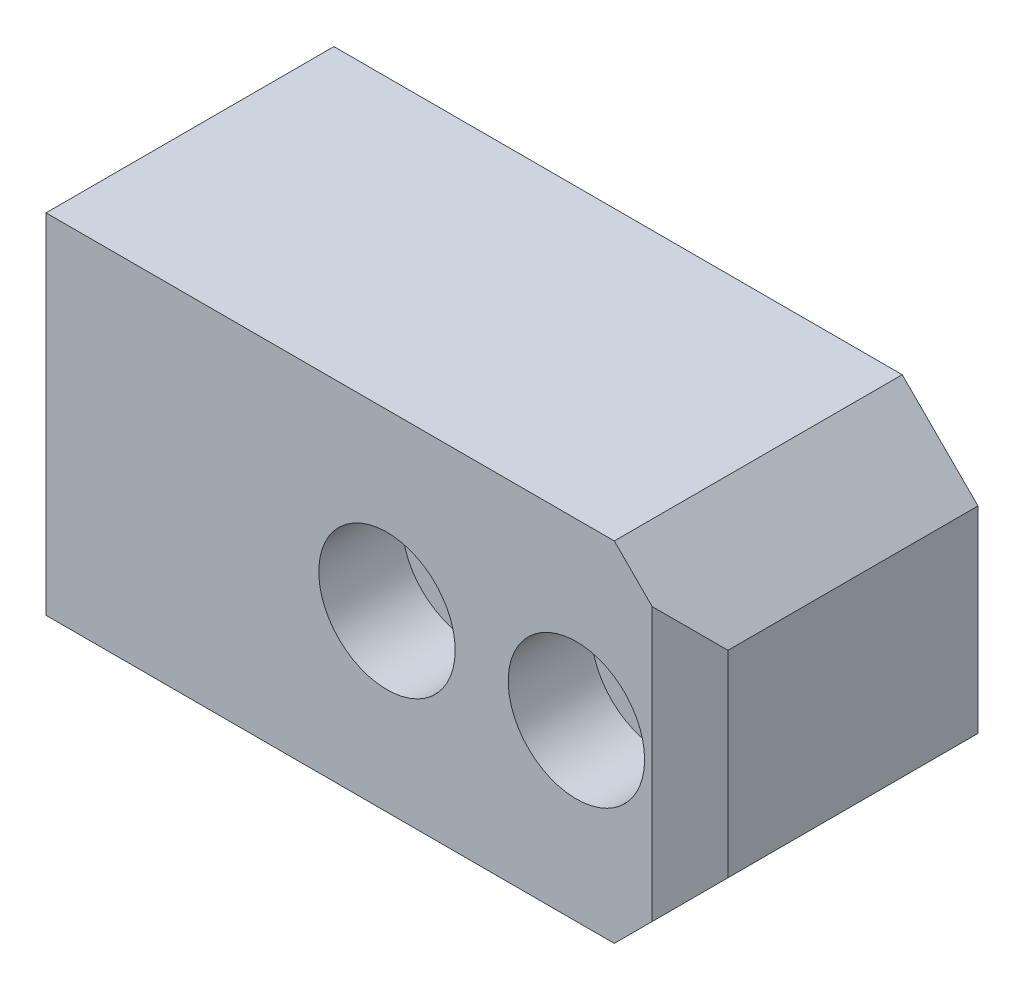
from build123d import *

# Parameters (mm, degrees)
SKETCH_1_W                = 85
SKETCH_1_H                = 46
EXTRUDE_1_DEPTH           = 38
HOLE_WIZARD_1_D           = 11
HOLE_WIZARD_1_CBORE_D     = 18
HOLE_WIZARD_1_CBORE_DEPTH = 11
CHAMFER_1_SIZE            = 10
CHAMFER_2_SIZE            = 5


with BuildPart() as part:
    # 草图1 → 凸台-拉伸1 (new body)
    with BuildSketch(Plane.XY):
        Rectangle(SKETCH_1_W, SKETCH_1_H)
    extrude(amount=EXTRUDE_1_DEPTH)

    # 打孔尺寸(%根据)内六角圆柱头螺钉的类型1 (through all)
    with Locations(Plane.XY.offset(38)):
        with Locations((2.5, 0), (27.5, 0)):
            CounterBoreHole(HOLE_WIZARD_1_D / 2, HOLE_WIZARD_1_CBORE_D / 2, HOLE_WIZARD_1_CBORE_DEPTH)

    # 倒角1
    chamfer_1_edges = [part.edges().sort_by_distance(p)[0] for p in [
        (42.5, 23, 19),
        (42.5, -23, 19),
    ]]
    chamfer(chamfer_1_edges, length=CHAMFER_1_SIZE)

    # 倒角2
    chamfer_2_edges = [part.edges().sort_by_distance(p)[0] for p in [
        (42.5, 0, 38),
    ]]
    chamfer(chamfer_2_edges, length=CHAMFER_2_SIZE)


solid = part.part
